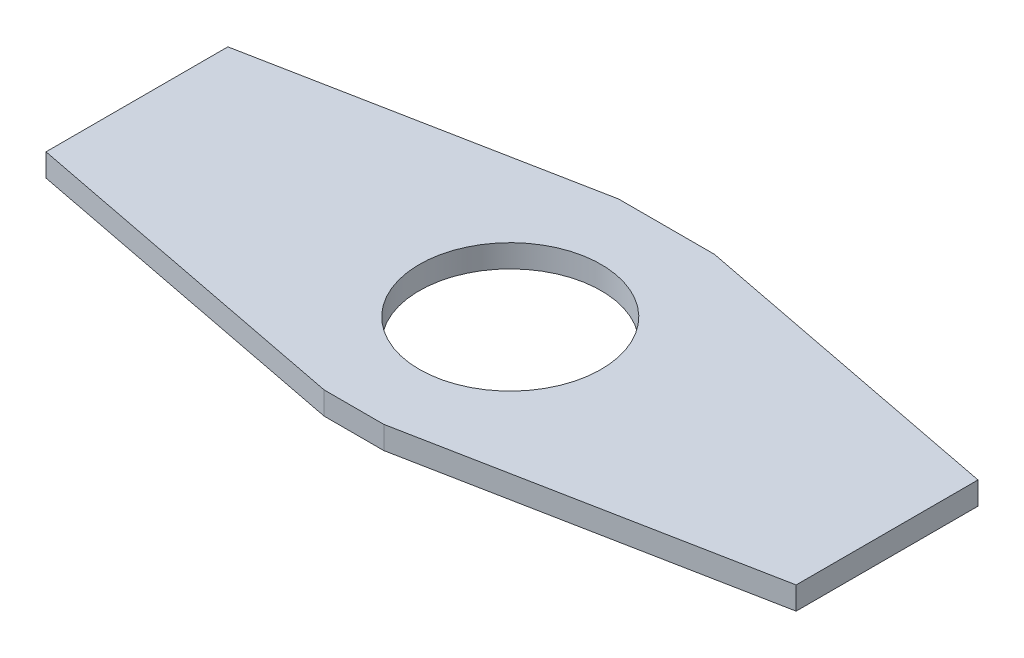
from build123d import *

# Parameters (mm, degrees)
SKETCH2_R           = 16
BOSS_EXTRUDE1_DEPTH = 4


with BuildPart() as part:
    # Sketch2 → Boss-Extrude1 (new body)
    with BuildSketch(Plane(origin=(0, 0, 0), x_dir=(1, 0, 0), z_dir=(0, 1, 0))):
        Polygon((-66, 16.30860378), (-66, -15.69139622), (-5.25, -27.5), (5.25, -27.5), (66, -15.69139622), (66, 16.30860378), (8.425257633, 27.5), (-8.425257633, 27.5), align=None)
        with Locations(Location((0, 0, 0), (0, 0, 270))):
            Circle(SKETCH2_R, mode=Mode.SUBTRACT)
    extrude(amount=BOSS_EXTRUDE1_DEPTH)


solid = part.part
